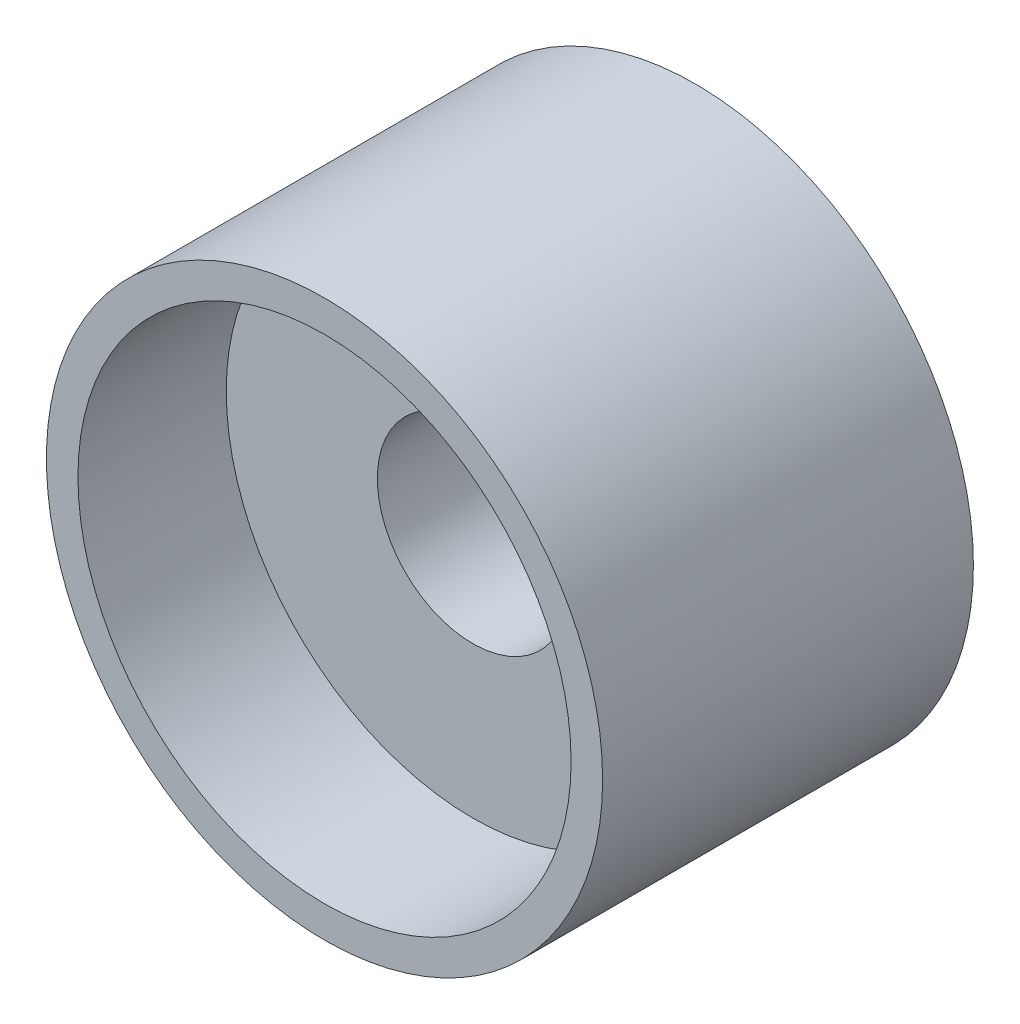
from build123d import *

# Parameters (mm, degrees)
SKETCH1_R           = 15
SKETCH1_R_2         = 5.15
BOSS_EXTRUDE1_DEPTH = 20
SKETCH2_R           = 13.3
CUT_EXTRUDE1_DEPTH  = 8


with BuildPart() as part:
    # Sketch1 → Boss-Extrude1 (new body)
    with BuildSketch(Plane.XY):
        Circle(SKETCH1_R)
        Circle(SKETCH1_R_2, mode=Mode.SUBTRACT)
    extrude(amount=BOSS_EXTRUDE1_DEPTH)

    # Sketch2 → Cut-Extrude1 (cut)
    with BuildSketch(Plane.XY.offset(20)):
        Circle(SKETCH2_R)
    extrude(amount=-CUT_EXTRUDE1_DEPTH, mode=Mode.SUBTRACT)


solid = part.part
